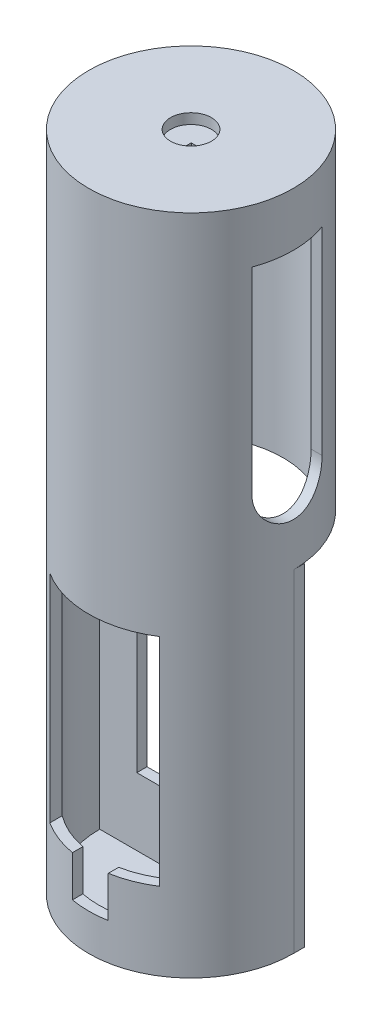
from build123d import *

# Parameters (mm, degrees)
SKETCH1_R           = 20
SKETCH1_R_2         = 18
BOSS_EXTRUDE1_DEPTH = 65
SKETCH2_R           = 18
BOSS_EXTRUDE2_DEPTH = 2
SKETCH4_W           = 24.70942711
SKETCH4_H           = 65
CUT_EXTRUDE1_DEPTH  = 79.89866919
SKETCH5_W           = 39.998874984
SKETCH5_H           = 65
BOSS_EXTRUDE3_DEPTH = 2
SKETCH6_W           = 21.5
SKETCH6_H           = 42.3
CUT_EXTRUDE2_DEPTH  = 72.523580028
SKETCH7_R           = 1
CUT_EXTRUDE3_DEPTH  = 2
SKETCH8_W           = 1
SKETCH8_H           = 55
CUT_EXTRUDE4_DEPTH  = 1.5
BOSS_EXTRUDE4_START = -2.4
SKETCH9_R           = 18
BOSS_EXTRUDE4_DEPTH = 2.4
CUT_EXTRUDE5_DEPTH  = 79.89866919
SKETCH11_R          = 18.596328204
SKETCH11_W          = 22.6
SKETCH11_H          = 12.5
BOSS_EXTRUDE6_DEPTH = 2
SKETCH12_R          = 0.5
CUT_EXTRUDE6_DEPTH  = 3
SKETCH15_R          = 4
CUT_EXTRUDE8_DEPTH  = 5
SKETCH16_R          = 20
CUT_EXTRUDE9_DEPTH  = 0.4
SKETCH18_W          = 7
SKETCH18_H          = 8
CUT_EXTRUDE10_DEPTH = 71.929701261


with BuildPart() as part:
    # Sketch1 → Boss-Extrude1 (new, symmetric)
    with BuildSketch(Plane(origin=(0, 0, 0), x_dir=(1, 0, 0), z_dir=(0, 1, 0))):
        with Locations(Location((0, 0, 0), (0, 0, 270))):
            Circle(SKETCH1_R)
        with Locations(Location((0, 0, 0), (0, 0, 270))):
            Circle(SKETCH1_R_2, mode=Mode.SUBTRACT)
    extrude(amount=BOSS_EXTRUDE1_DEPTH, both=True)

    # Sketch2 → Boss-Extrude2 (add)
    with BuildSketch(Plane.XZ.offset(65)):
        with Locations(Location((0, 0, 0), (0, 0, 270))):
            Circle(SKETCH2_R)
    extrude(amount=-BOSS_EXTRUDE2_DEPTH)

    # Sketch4 → Cut-Extrude1 (cut, through all)
    with BuildSketch(Plane(origin=(20, 0, 0), x_dir=(0, 0, -1), z_dir=(1, 0, 0))):
        with Locations((12.504713555, -32.5)):
            Rectangle(SKETCH4_W, SKETCH4_H)
    extrude(amount=-CUT_EXTRUDE1_DEPTH, mode=Mode.SUBTRACT)

    # Sketch5 → Boss-Extrude3 (add)
    with BuildSketch(Plane(origin=(0, 0, -0.15), x_dir=(-1, 0, 0), z_dir=(0, 0, -1))):
        with Locations((0, -32.5)):
            Rectangle(SKETCH5_W, SKETCH5_H)
    extrude(amount=BOSS_EXTRUDE3_DEPTH)

    # Sketch6 → Cut-Extrude2 (cut, through all)
    with BuildSketch(Plane(origin=(0, 0, -2.15), x_dir=(-1, 0, 0), z_dir=(0, 0, -1))):
        with Locations((0, -28.65)):
            Rectangle(SKETCH6_W, SKETCH6_H)
    extrude(amount=-CUT_EXTRUDE2_DEPTH, mode=Mode.SUBTRACT)

    # Sketch7 → Cut-Extrude3 (cut)
    with BuildSketch(Plane(origin=(0, 0, -2.15), x_dir=(-1, 0, 0), z_dir=(0, 0, -1))):
        with Locations((-5, -4.3)):
            Circle(SKETCH7_R)
        with Locations((-5, -52.3)):
            Circle(SKETCH7_R)
        with Locations(Location((5, -52.3, 0), (0, 0, 180))):
            Circle(SKETCH7_R)
        with Locations(Location((5, -4.3, 0), (0, 0, 180))):
            Circle(SKETCH7_R)
    extrude(amount=-CUT_EXTRUDE3_DEPTH, mode=Mode.SUBTRACT)

    # Sketch8 → Cut-Extrude4 (cut)
    with BuildSketch(Plane.XY.offset(-0.15)):
        with Locations((0, -28.3)):
            Rectangle(SKETCH8_W, SKETCH8_H)
    extrude(amount=-CUT_EXTRUDE4_DEPTH, mode=Mode.SUBTRACT)

    # Sketch9 → Boss-Extrude4 (add)
    with BuildSketch(Plane(origin=(0, 65, 0), x_dir=(1, 0, 0), z_dir=(0, 1, 0)).offset(BOSS_EXTRUDE4_START)):
        with Locations(Location((0, 0, 0), (0, 0, 6.860040985))):
            Circle(SKETCH9_R)
    extrude(amount=BOSS_EXTRUDE4_DEPTH)

    # Sketch10 → Cut-Extrude5 (cut, through all)
    with BuildSketch(Plane(origin=(20, 0, 0), x_dir=(0, 0, -1), z_dir=(1, 0, 0))):
        with BuildLine():
            Line((-6.85, 54.1), (6.85, 54.1))
            Line((6.85, 54.1), (6.85, 15.35))
            ThreePointArc((6.85, 15.35), (0, 8.5), (-6.85, 15.35))
            Line((-6.85, 15.35), (-6.85, 54.1))
        make_face()
    extrude(amount=-CUT_EXTRUDE5_DEPTH, mode=Mode.SUBTRACT)

    # Sketch11 → Boss-Extrude6 (add)
    with BuildSketch(Plane.XZ.offset(-54.1)):
        Circle(SKETCH11_R)
        with Locations((5.1, 0)):
            Rectangle(SKETCH11_W, SKETCH11_H, mode=Mode.SUBTRACT)
    extrude(amount=-BOSS_EXTRUDE6_DEPTH)

    # Sketch12 → Cut-Extrude6 (cut)
    with BuildSketch(Plane.XZ.offset(-54.1)):
        with Locations(Location((18.9, 0, 0), (0, 0, 270))):
            Circle(SKETCH12_R)
        with Locations(Location((-8.7, 0, 0), (0, 0, 270))):
            Circle(SKETCH12_R)
    extrude(amount=-CUT_EXTRUDE6_DEPTH, mode=Mode.SUBTRACT)

    # Sketch15 → Cut-Extrude8 (cut)
    with BuildSketch(Plane(origin=(0, 65, 0), x_dir=(1, 0, 0), z_dir=(0, 1, 0))):
        with Locations(Location((0, 0, 0), (0, 0, 270))):
            Circle(SKETCH15_R)
    extrude(amount=-CUT_EXTRUDE8_DEPTH, mode=Mode.SUBTRACT)

    # Sketch16 → Cut-Extrude9 (cut)
    with BuildSketch(Plane(origin=(0, 65, 0), x_dir=(1, 0, 0), z_dir=(0, 1, 0))):
        with Locations(Location((0, 0, 0), (0, 0, 6.171221478))):
            Circle(SKETCH16_R)
    extrude(amount=-CUT_EXTRUDE9_DEPTH, mode=Mode.SUBTRACT)

    # Sketch18 → Cut-Extrude10 (cut, through all)
    with BuildSketch(Plane.XY.offset(-0.15)):
        with Locations((0, -53.8)):
            Rectangle(SKETCH18_W, SKETCH18_H)
    extrude(amount=CUT_EXTRUDE10_DEPTH, mode=Mode.SUBTRACT)


solid = part.part
